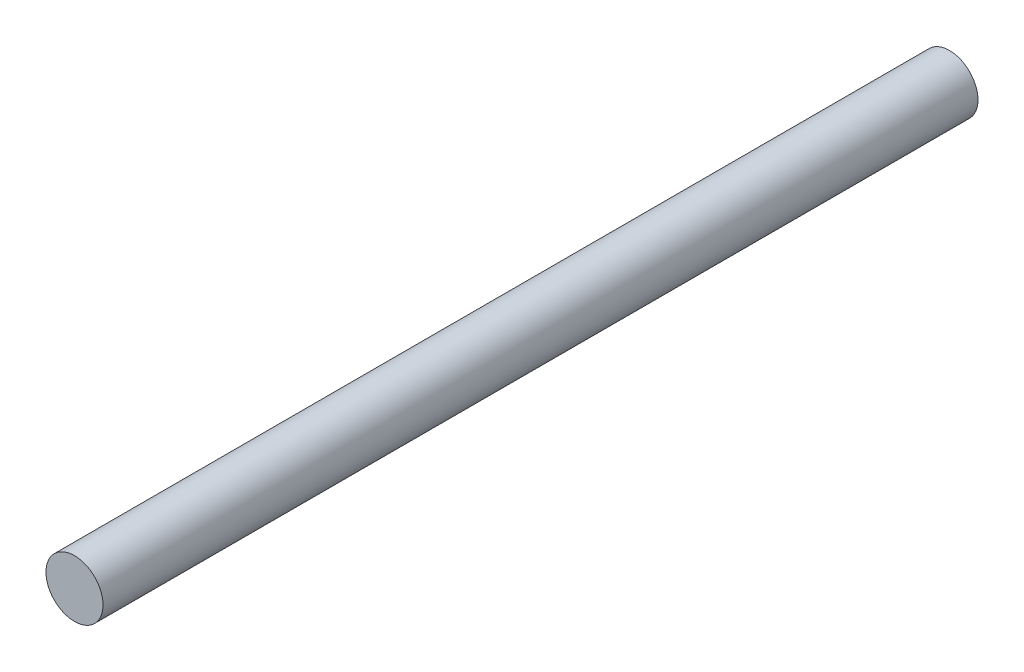
from build123d import *

# Parameters (mm, degrees)
CROQUIS1_R              = 1.5
SALIENTE_EXTRUIR1_DEPTH = 46


with BuildPart() as part:
    # Croquis1 → Saliente-Extruir1 (new body)
    with BuildSketch(Plane.XY):
        Circle(CROQUIS1_R)
    extrude(amount=SALIENTE_EXTRUIR1_DEPTH)


solid = part.part
